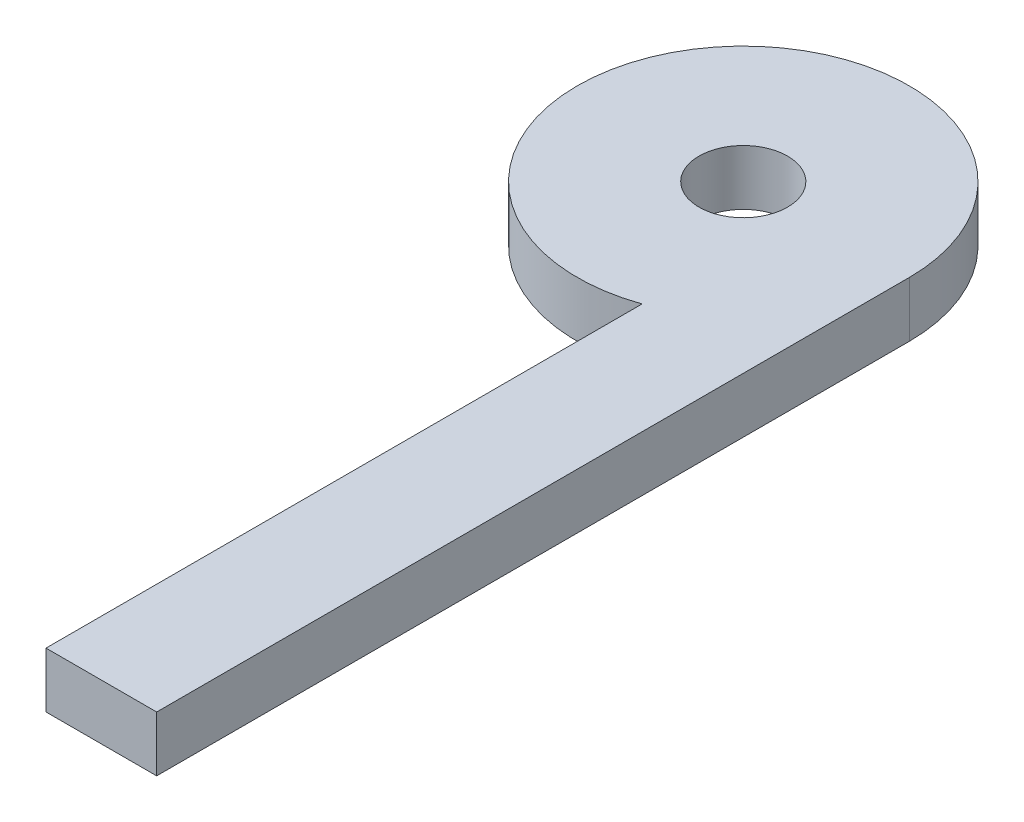
from build123d import *

# Parameters (mm, degrees)
SKETCH1_R           = 19.05
BOSS_EXTRUDE1_DEPTH = 6.35
SKETCH2_W           = 12.7
SKETCH2_H           = 86.36
BOSS_EXTRUDE2_DEPTH = 6.35
SKETCH3_R           = 5.08
CUT_EXTRUDE1_DEPTH  = 6.35


with BuildPart() as part:
    # Sketch1 → Boss-Extrude1 (new body)
    with BuildSketch(Plane(origin=(0, 0, 0), x_dir=(1, 0, 0), z_dir=(0, 1, 0))):
        with Locations(Location((0, 0, 0), (0, 0, 270))):
            Circle(SKETCH1_R)
    extrude(amount=BOSS_EXTRUDE1_DEPTH)

    # Sketch2 → Boss-Extrude2 (add)
    with BuildSketch(Plane.XZ):
        with Locations((12.7, 43.18)):
            Rectangle(SKETCH2_W, SKETCH2_H)
    extrude(amount=-BOSS_EXTRUDE2_DEPTH)

    # Sketch3 → Cut-Extrude1 (cut)
    with BuildSketch(Plane.XZ):
        with Locations(Location((0, 0, 0), (0, 0, 270))):
            Circle(SKETCH3_R)
    extrude(amount=-CUT_EXTRUDE1_DEPTH, mode=Mode.SUBTRACT)


solid = part.part
